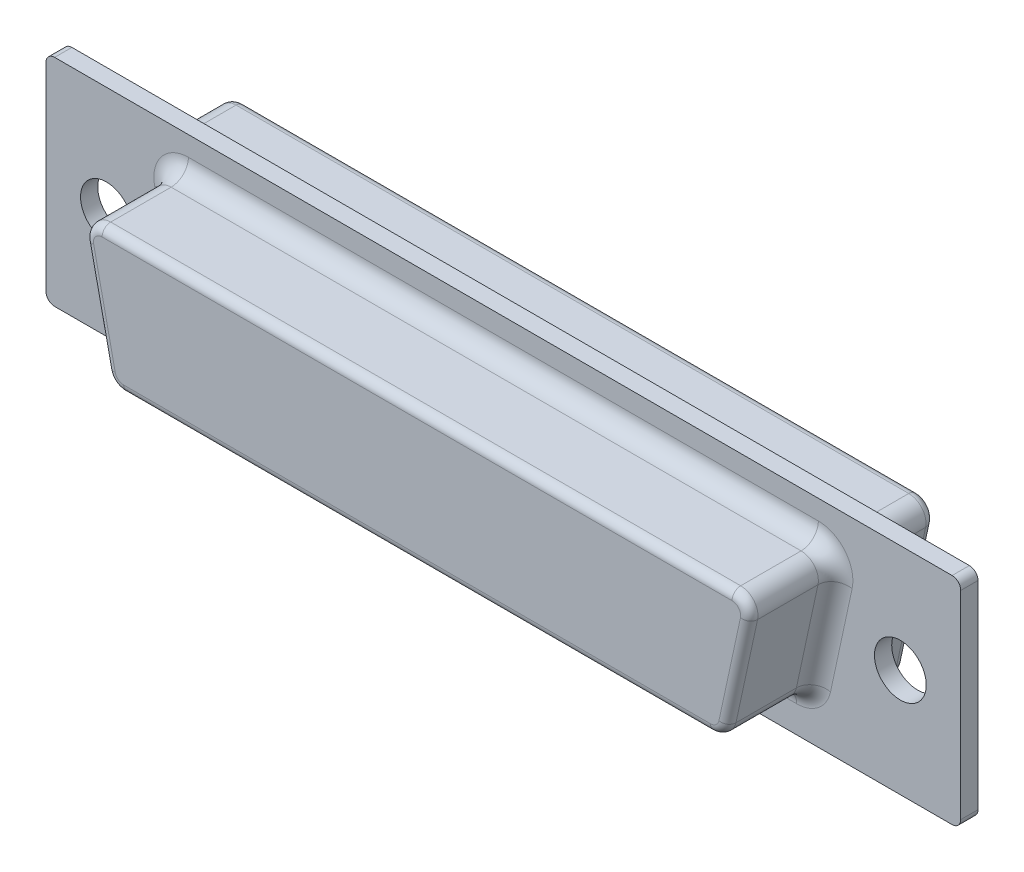
from build123d import *

# Parameters (mm, degrees)
SKETCH1_W           = 53
SKETCH1_H           = 12.5
BOSS_EXTRUDE1_DEPTH = 1
BOSS_EXTRUDE2_DEPTH = 5
SKETCH3_R           = 1.5
CUT_EXTRUDE1_DEPTH  = 28.682349973
FILLET1_R           = 1
FILLET2_R           = 0.5
BOSS_EXTRUDE3_DEPTH = 3.5
FILLET3_R           = 0.5


with BuildPart() as part:
    # Sketch1 → Boss-Extrude1 (new body)
    with BuildSketch(Plane.XY):
        Rectangle(SKETCH1_W, SKETCH1_H)
    extrude(amount=BOSS_EXTRUDE1_DEPTH)

    # Sketch2 → Boss-Extrude2 (add)
    with BuildSketch(Plane.XY.offset(1)):
        with BuildLine():
            Line((19.227555087, 2.9), (17.977555087, -2.9))
            ThreePointArc((17.977555087, -2.9), (17.628219716, -3.467356005), (17, -3.689320024))
            Line((17, -3.689320024), (-17, -3.689320024))
            ThreePointArc((-17, -3.689320024), (-17.628219716, -3.467356005), (-17.977555087, -2.9))
            Line((-17.977555087, -2.9), (-19.227555087, 2.9))
            ThreePointArc((-19.227555087, 2.9), (-19.028035981, 3.738899692), (-18.25, 4.110679976))
            Line((-18.25, 4.110679976), (18.25, 4.110679976))
            ThreePointArc((18.25, 4.110679976), (19.028035981, 3.738899692), (19.227555087, 2.9))
        make_face()
    extrude(amount=BOSS_EXTRUDE2_DEPTH)

    # Sketch3 → Cut-Extrude1 (cut, through all)
    with BuildSketch(Plane.XY.offset(1)):
        with Locations((-23, 0)):
            Circle(SKETCH3_R)
        with Locations(Location((23, 0, 0), (0, 0, 180))):
            Circle(SKETCH3_R)
    extrude(amount=-CUT_EXTRUDE1_DEPTH, mode=Mode.SUBTRACT)

    # Fillet1
    fillet1_edges = [part.edges().sort_by_distance(p)[0] for p in [
        (17.628219716, -3.467356005, 1),
        (18.602555087, 0, 1),
        (19.028035981, 3.738899692, 1),
        (0, 4.110679976, 1),
        (-19.028035981, 3.738899692, 1),
        (-18.602555087, 0, 1),
        (-17.628219716, -3.467356005, 1),
        (0, -3.689320024, 1),
    ]]
    fillet(fillet1_edges, radius=FILLET1_R)

    # Fillet2
    fillet2_edges = [part.edges().sort_by_distance(p)[0] for p in [
        (17.628219716, -3.467356005, 6),
        (18.602555087, 0, 6),
        (19.028035981, 3.738899692, 6),
        (0, 4.110679976, 6),
        (-19.028035981, 3.738899692, 6),
        (-18.602555087, 0, 6),
        (-17.628219716, -3.467356005, 6),
        (0, -3.689320024, 6),
        (26.5, -6.25, 0.5),
        (-26.5, -6.25, 0.5),
        (-26.5, 6.25, 0.5),
        (26.5, 6.25, 0.5),
    ]]
    fillet(fillet2_edges, radius=FILLET2_R)

    # Sketch5 → Boss-Extrude3 (add)
    with BuildSketch(Plane(origin=(0, 0, 0), x_dir=(-1, 0, 0), z_dir=(0, 0, -1))):
        with BuildLine():
            Line((-19.488477495, 5.110679976), (19.488477495, 5.110679976))
            ThreePointArc((19.488477495, 5.110679976), (20.266513476, 4.738899692), (20.466032582, 3.9))
            Line((20.466032582, 3.9), (18.7849981, -3.9))
            ThreePointArc((18.7849981, -3.9), (18.435662729, -4.467356005), (17.807443013, -4.689320024))
            Line((17.807443013, -4.689320024), (-17.807443013, -4.689320024))
            ThreePointArc((-17.807443013, -4.689320024), (-18.435662729, -4.467356005), (-18.7849981, -3.9))
            Line((-18.7849981, -3.9), (-20.466032582, 3.9))
            ThreePointArc((-20.466032582, 3.9), (-20.266513476, 4.738899692), (-19.488477495, 5.110679976))
        make_face()
    extrude(amount=BOSS_EXTRUDE3_DEPTH)

    # Fillet3
    fillet3_edges = [part.edges().sort_by_distance(p)[0] for p in [
        (18.435662729, -4.467356005, 0),
        (0, -4.689320024, 0),
        (-18.435662729, -4.467356005, 0),
        (-19.625515341, 0, 0),
        (-20.266513476, 4.738899692, 0),
        (0, 5.110679976, 0),
        (20.266513476, 4.738899692, 0),
        (19.625515341, 0, 0),
        (18.435662729, -4.467356005, -3.5),
        (0, -4.689320024, -3.5),
        (-18.435662729, -4.467356005, -3.5),
        (-19.625515341, 0, -3.5),
        (-20.266513476, 4.738899692, -3.5),
        (0, 5.110679976, -3.5),
        (20.266513476, 4.738899692, -3.5),
        (19.625515341, 0, -3.5),
    ]]
    fillet(fillet3_edges, radius=FILLET3_R)


solid = part.part
